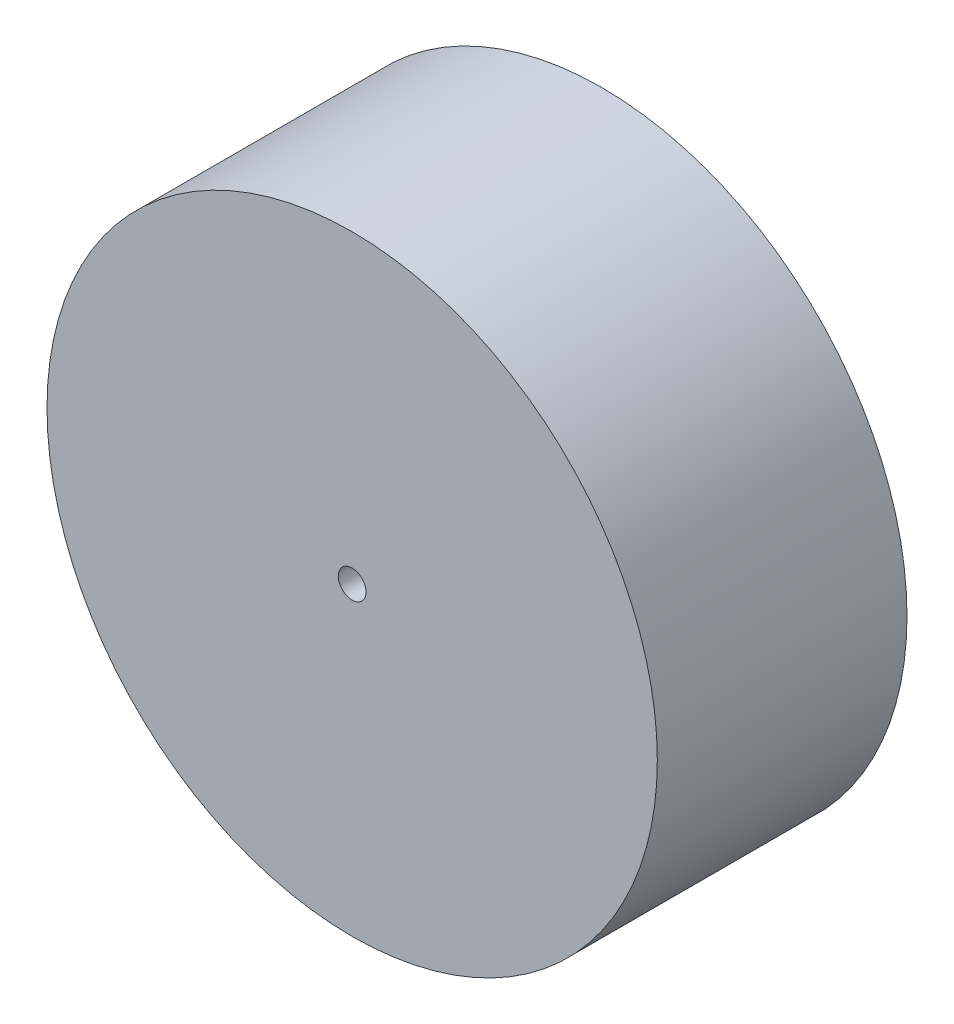
from build123d import *

# Parameters (mm, degrees)
SKETCH_1_R          = 33
EXTRUDE_1_DEPTH     = 27
SKETCH_2_R          = 1.5
CUT_EXTRUDE_1_DEPTH = 54.916602267


with BuildPart() as part:
    # 草图1 → 凸台-拉伸1 (new body)
    with BuildSketch(Plane.XY):
        Circle(SKETCH_1_R)
    extrude(amount=EXTRUDE_1_DEPTH)

    # 草图2 → 切除-拉伸1 (cut, through all)
    with BuildSketch(Plane.XY.offset(27)):
        Circle(SKETCH_2_R)
    extrude(amount=-CUT_EXTRUDE_1_DEPTH, mode=Mode.SUBTRACT)


solid = part.part
